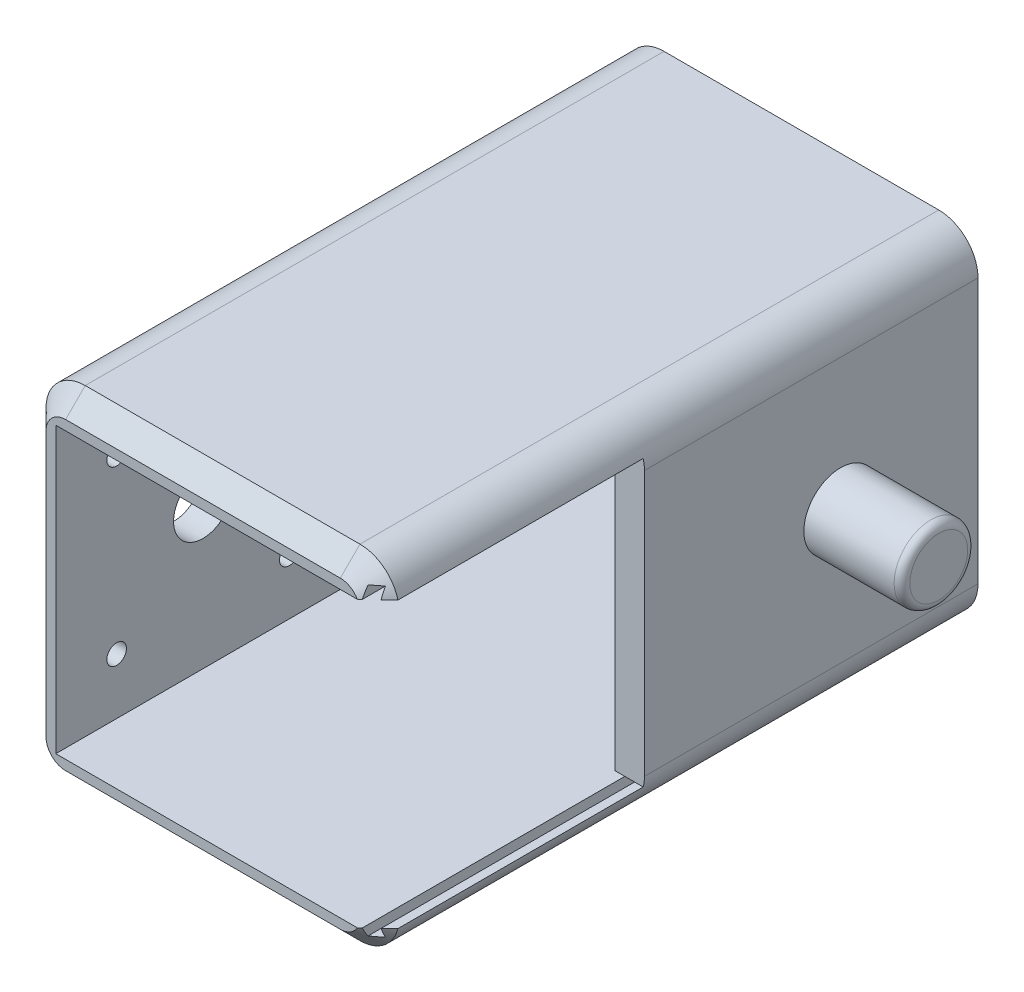
from build123d import *

# Parameters (mm, degrees)
BOSS_EXTRUDE1_DEPTH = 77.47
SKETCH2_W           = 43.18
SKETCH2_H           = 44.45
BOSS_EXTRUDE2_DEPTH = 3.81
SKETCH3_R           = 3.81
SKETCH3_R_2         = 1.27
CUT_EXTRUDE1_DEPTH  = 3.81
SKETCH4_R           = 4.7625
BOSS_EXTRUDE3_DEPTH = 12.7
BOSS_EXTRUDE4_START = 12.7
SKETCH5_R           = 4.7625
BOSS_EXTRUDE4_DEPTH = 12.7
FILLET1_R           = 1.016
SKETCH6_W           = 1.27
SKETCH6_H           = 38.1
CUT_EXTRUDE2_DEPTH  = 1.27
FILLET2_R           = 5.08
CHAMFER1_SIZE       = 2.54


with BuildPart() as part:
    # Sketch1 → Boss-Extrude1 (new body)
    with BuildSketch(Plane.XY):
        Polygon((0, 0), (-41.91, 0), (-41.91, -36.83), (0, -36.83), (0, -40.64), (-41.91, -40.64), (-45.72, -40.64), (-45.72, 0), (-45.72, 3.81), (0, 3.81), align=None)
    extrude(amount=BOSS_EXTRUDE1_DEPTH)

    # Sketch2 → Boss-Extrude2 (add)
    with BuildSketch(Plane(origin=(0, 0, 0), x_dir=(0, 0, -1), z_dir=(1, 0, 0))):
        with Locations((-21.59, -18.415)):
            Rectangle(SKETCH2_W, SKETCH2_H)
    extrude(amount=-BOSS_EXTRUDE2_DEPTH)

    # Sketch3 → Cut-Extrude1 (cut)
    with BuildSketch(Plane.ZY.offset(45.72)):
        with Locations(Location((58.42, -18.415, 0), (0, 0, 270))):
            Circle(SKETCH3_R)
        with Locations(Location((47.244, -7.239, 0), (0, 0, 270))):
            Circle(SKETCH3_R_2)
        with Locations(Location((69.596, -7.239, 0), (0, 0, 270))):
            Circle(SKETCH3_R_2)
        with Locations(Location((69.596, -29.591, 0), (0, 0, 270))):
            Circle(SKETCH3_R_2)
        with Locations(Location((47.244, -29.591, 0), (0, 0, 270))):
            Circle(SKETCH3_R_2)
    extrude(amount=-CUT_EXTRUDE1_DEPTH, mode=Mode.SUBTRACT)

    # Sketch4 → Boss-Extrude3 (add)
    with BuildSketch(Plane.ZY.offset(45.72)):
        with Locations(Location((17.78, -18.415, 0), (0, 0, 90))):
            Circle(SKETCH4_R)
    extrude(amount=BOSS_EXTRUDE3_DEPTH)

    # Sketch5 → Boss-Extrude4 (add)
    with BuildSketch(Plane(origin=(0, 0, 0), x_dir=(0, 0, -1), z_dir=(1, 0, 0)).offset(BOSS_EXTRUDE4_START)):
        with Locations(Location((-17.78, -18.415, 0), (0, 0, 90))):
            Circle(SKETCH5_R)
    extrude(amount=-BOSS_EXTRUDE4_DEPTH)

    # Fillet1
    fillet1_edges = [part.edges().sort_by_distance(p)[0] for p in [
        (-58.42, -23.1775, 17.78),
        (12.7, -23.1775, 17.78),
    ]]
    fillet(fillet1_edges, radius=FILLET1_R)

    # Sketch6 → Cut-Extrude2 (cut)
    with BuildSketch(Plane.XZ):
        with Locations((-1.905, 58.42)):
            Rectangle(SKETCH6_W, SKETCH6_H)
    cut_extrude2 = extrude(amount=-CUT_EXTRUDE2_DEPTH, mode=Mode.SUBTRACT)

    # Mirror1: Cut-Extrude2 across plane
    add(cut_extrude2.mirror(Plane(origin=(0, -18.415, 0), x_dir=(0, 0, 1), z_dir=(0, -1, 0))), mode=Mode.SUBTRACT)

    # Fillet2
    fillet2_edges = [part.edges().sort_by_distance(p)[0] for p in [
        (-45.72, 3.81, 38.735),
        (0, 3.81, 38.735),
        (0, -40.64, 38.735),
        (-45.72, -40.64, 38.735),
    ]]
    fillet(fillet2_edges, radius=FILLET2_R)

    # Chamfer1
    chamfer1_edges = [part.edges().sort_by_distance(p)[0] for p in [
        (-1.969148027, -39.576092628, 77.47),
        (-22.86, -40.64, 77.47),
        (-44.232102448, -39.152102448, 77.47),
        (-45.72, -18.415, 77.47),
        (-1.969148027, 2.746092628, 77.47),
        (-44.232102448, 2.322102448, 77.47),
        (-22.86, 3.81, 77.47),
    ]]
    chamfer(chamfer1_edges, length=CHAMFER1_SIZE)


solid = part.part
